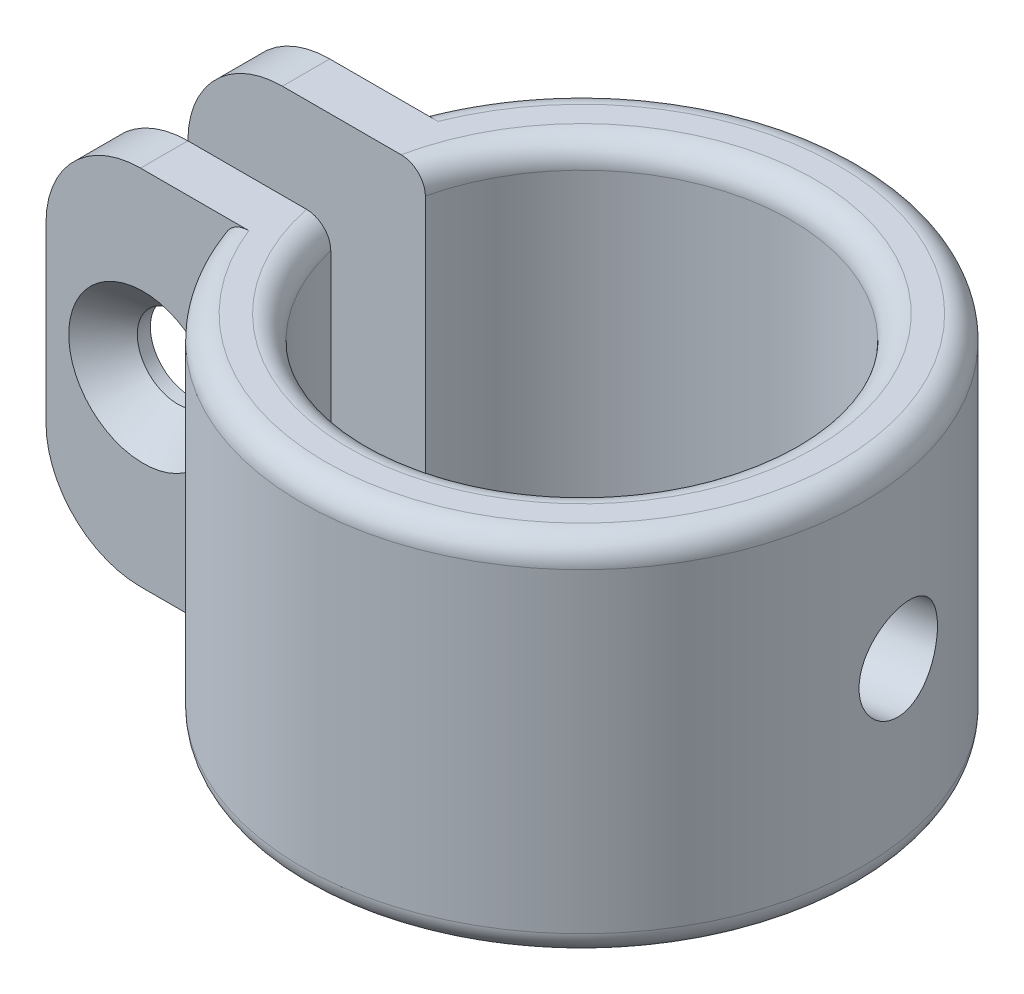
from build123d import *

# Parameters (mm, degrees)
SKETCH1_W                                       = 3
SKETCH1_H                                       = 15.333447248
FILLET1_R                                       = 1
SKETCH3_W                                       = 6.675810252
SKETCH3_H                                       = 15.659008314
CUT_EXTRUDE1_DEPTH                              = 2
BOSS_EXTRUDE1_START                             = -2
BOSS_EXTRUDE1_DEPTH                             = 2
CSK_FOR_M3_FLAT_HEAD_MACHINE_SCREW1_D           = 3.4
CSK_FOR_M3_FLAT_HEAD_MACHINE_SCREW1_DEPTH       = 10.05
CSK_FOR_M3_FLAT_HEAD_MACHINE_SCREW1_CSINK_D     = 6.3
CSK_FOR_M3_FLAT_HEAD_MACHINE_SCREW1_CSINK_ANGLE = 90
CSK_FOR_M3_FLAT_HEAD_MACHINE_SCREW1_TIP         = 1.021463052
CUT_EXTRUDE2_DEPTH                              = 1
F_4_0MM_DOWEL_HOLE1_D                           = 4
F_4_0MM_DOWEL_HOLE1_DEPTH                       = 10.05
F_4_0MM_DOWEL_HOLE1_TIP                         = 1.201721238


with BuildPart() as part:
    # Sketch1 → Revolve1 (revolve)
    with BuildSketch(Plane.XY, mode=Mode.PRIVATE) as revolve1_sk:
        with Locations((10.35, 44.609155007)):
            Rectangle(SKETCH1_W, SKETCH1_H)
    revolve(revolve1_sk.sketch.rotate(Axis((0, 0, 0), (0, 1, 0)), 90), axis=Axis((0, 0, 0), (0, 1, 0)))

    # Fillet1
    fillet1_edges = [part.edges().sort_by_distance(p)[0] for p in [
        (0, 36.942431383, 11.85),
        (0, 36.942431383, 8.85),
        (0, 52.275878631, 8.85),
        (0, 52.275878631, 11.85),
    ]]
    fillet(fillet1_edges, radius=FILLET1_R)

    # Sketch3 → Cut-Extrude1 (cut, symmetric)
    with BuildSketch(Plane.XY):
        with Locations((-11.106180129, 44.609155007)):
            Rectangle(SKETCH3_W, SKETCH3_H)
    extrude(amount=CUT_EXTRUDE1_DEPTH, both=True, mode=Mode.SUBTRACT)

    # Sketch4 → Boss-Extrude1 (add)
    with BuildSketch(Plane.XY.offset(BOSS_EXTRUDE1_START)):
        with BuildLine():
            Line((-9.644817261, 36.942431383), (-10.664075206, 36.942431383))
            Line((-10.664075206, 36.942431383), (-14.664075206, 36.942431383))
            ThreePointArc((-14.664075206, 36.942431383), (-17.492502331, 38.114004258), (-18.664075206, 40.942431383))
            Line((-18.664075206, 40.942431383), (-18.664075206, 48.275878631))
            ThreePointArc((-18.664075206, 48.275878631), (-17.492502331, 51.104305755), (-14.664075206, 52.275878631))
            Line((-14.664075206, 52.275878631), (-10.664075206, 52.275878631))
            Line((-10.664075206, 52.275878631), (-9.644817261, 52.275878631))
            add(Edge.make_bspline(
                [(-9.644817261, 52.275878631), (-9.378798385, 52.275878631), (-9.116878333, 52.171728166), (-8.829392504, 51.894086813), (-8.752947616, 51.783744007), (-8.64842333, 51.540454721), (-8.62104982, 51.407772929), (-8.62104982, 51.275878631)],
                knots=[0, 0, 0, 0, 0.5, 0.5, 0.75, 0.75, 1, 1, 1, 1], degree=3))
            Line((-8.62104982, 51.275878631), (-8.62104982, 37.942431383))
            add(Edge.make_bspline(
                [(-8.62104982, 37.942431383), (-8.62104982, 37.809600722), (-8.648565858, 37.677546578), (-8.752751433, 37.434999617), (-8.830122554, 37.323612145), (-9.019571897, 37.14046256), (-9.133364658, 37.066938176), (-9.378224589, 36.968436457), (-9.512545153, 36.942431383), (-9.644817261, 36.942431383)],
                knots=[0, 0, 0, 0, 0.25, 0.25, 0.5, 0.5, 0.75, 0.75, 1, 1, 1, 1], degree=3))
        make_face()
    boss_extrude1 = extrude(amount=-BOSS_EXTRUDE1_DEPTH)

    # Mirror1: Boss-Extrude1 across plane
    add(boss_extrude1.mirror(Plane.XY))

    # CSK for M3 Flat Head Machine Screw1
    with Locations(Plane.XY.offset(4)):
        with Locations((-14.552315119, 44.666817053)):
            CounterSinkHole(CSK_FOR_M3_FLAT_HEAD_MACHINE_SCREW1_D / 2, CSK_FOR_M3_FLAT_HEAD_MACHINE_SCREW1_CSINK_D / 2, depth=CSK_FOR_M3_FLAT_HEAD_MACHINE_SCREW1_DEPTH, counter_sink_angle=CSK_FOR_M3_FLAT_HEAD_MACHINE_SCREW1_CSINK_ANGLE)
            with Locations((0, 0, -(CSK_FOR_M3_FLAT_HEAD_MACHINE_SCREW1_DEPTH + CSK_FOR_M3_FLAT_HEAD_MACHINE_SCREW1_TIP / 2))):  # 118° drill point
                Cone(0, CSK_FOR_M3_FLAT_HEAD_MACHINE_SCREW1_D / 2, CSK_FOR_M3_FLAT_HEAD_MACHINE_SCREW1_TIP, mode=Mode.SUBTRACT)

    # Sketch7 → Cut-Extrude2 (cut)
    with BuildSketch(Plane(origin=(0, 0, -4), x_dir=(-1, 0, 0), z_dir=(0, 0, -1))):
        Polygon((17.347299976, 46.292053338), (14.542311637, 47.899963085), (11.74732678, 46.2747268), (11.757330261, 43.041580768), (14.5623186, 41.433671021), (17.357303457, 43.058907306), align=None)
    extrude(amount=-CUT_EXTRUDE2_DEPTH, mode=Mode.SUBTRACT)

    # Ø4.0mm Dowel Hole1
    with Locations(Plane(origin=(11.701214373, 44.540807009, -1.871919391), x_dir=(0.157967881081, 0, 0.987444250855), z_dir=(0.987444250855, 0, -0.157967881081))):
        with Locations((0, 0)):
            Hole(F_4_0MM_DOWEL_HOLE1_D / 2, depth=F_4_0MM_DOWEL_HOLE1_DEPTH)
            with Locations((0, 0, -(F_4_0MM_DOWEL_HOLE1_DEPTH + F_4_0MM_DOWEL_HOLE1_TIP / 2))):  # 118° drill point
                Cone(0, F_4_0MM_DOWEL_HOLE1_D / 2, F_4_0MM_DOWEL_HOLE1_TIP, mode=Mode.SUBTRACT)


solid = part.part
